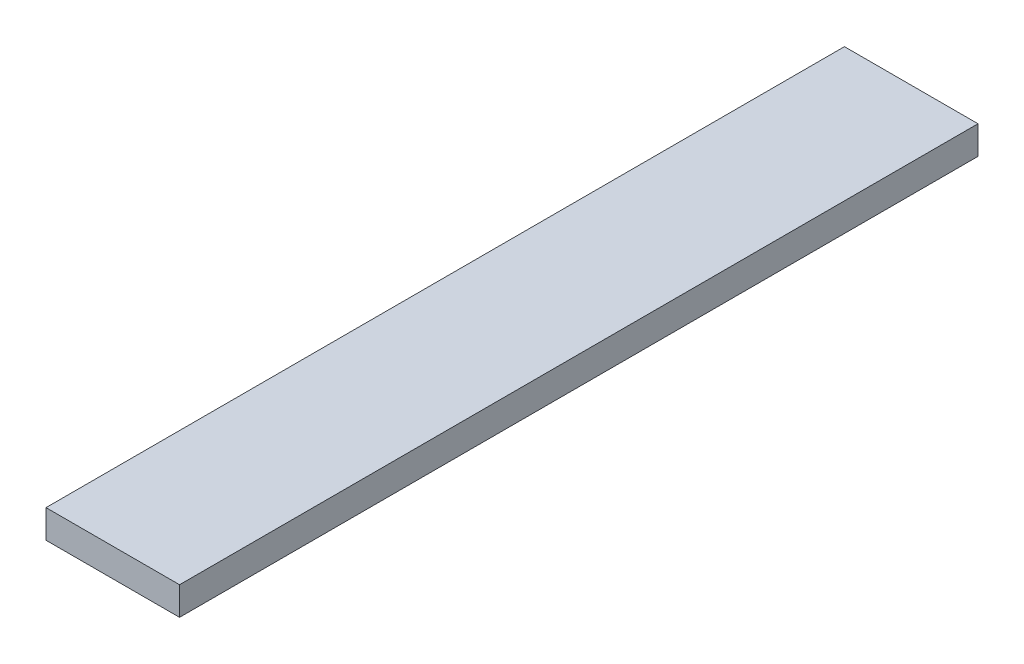
from build123d import *

# Parameters (mm, degrees)
SKETCH1_W           = 15
SKETCH1_H           = 3.175
BOSS_EXTRUDE1_DEPTH = 89.675


with BuildPart() as part:
    # Sketch1 → Boss-Extrude1 (new body)
    with BuildSketch(Plane.XY):
        with Locations((-17.5, 20.7875)):
            Rectangle(SKETCH1_W, SKETCH1_H)
    extrude(amount=-BOSS_EXTRUDE1_DEPTH)


solid = part.part
